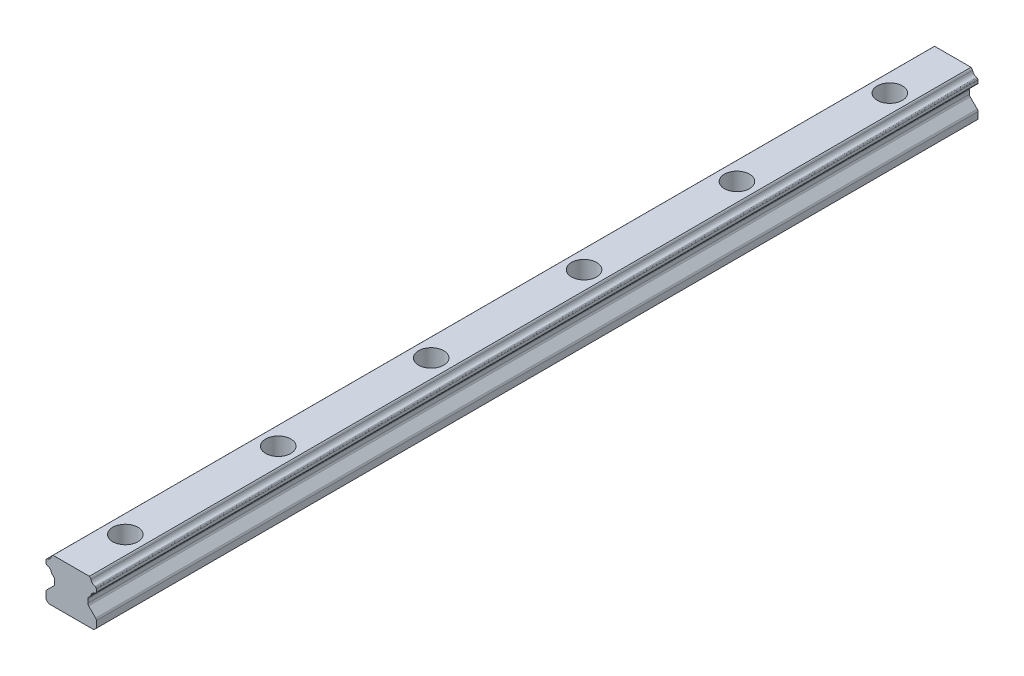
from build123d import *

# Parameters (mm, degrees)
HGR_HGR20_1_DEPTH                                   = 350
CBORE_FOR_M5_HEX_SOCKET_HEAD_CAP_SCREW1_D           = 5.8
CBORE_FOR_M5_HEX_SOCKET_HEAD_CAP_SCREW1_CBORE_D     = 10
CBORE_FOR_M5_HEX_SOCKET_HEAD_CAP_SCREW1_CBORE_DEPTH = 8.5
LPATTERN1_COUNT                                     = 6
LPATTERN1_PITCH                                     = 60.7


with BuildPart() as part:
    # Sketch12 → Hgr HGR20(1) (new body)
    with BuildSketch(Plane.XY):
        with BuildLine():
            Line((-9, 0), (9, 0))
            Line((9, 0), (10, 1))
            Line((10, 1), (10, 3.656507036))
            ThreePointArc((10, 3.656507036), (9.92387953, 4.039190479), (9.707106773, 4.363613837))
            Line((9.707106773, 4.363613837), (6.892893227, 7.177827383))
            ThreePointArc((6.892893227, 7.177827383), (6.67612047, 7.502250741), (6.6, 7.884934184))
            Line((6.6, 7.884934184), (6.6, 9.445065806))
            ThreePointArc((6.6, 9.445065806), (6.67612047, 9.827749249), (6.892893227, 10.152172607))
            Line((6.892893227, 10.152172607), (7.63016236, 10.88944174))
            ThreePointArc((7.63016236, 10.88944174), (7.773916168, 11.035785916), (7.84680643, 11.2275378))
            ThreePointArc((7.84680643, 11.2275378), (8.396388337, 12.262927707), (9.431778248, 12.812509604))
            ThreePointArc((9.431778248, 12.812509604), (9.57149389, 12.861817745), (9.690625667, 12.949905047))
            Line((9.690625667, 12.949905047), (9.85355341, 13.11283279))
            ThreePointArc((9.85355341, 13.11283279), (9.961939771, 13.275044443), (10, 13.466386134))
            Line((10, 13.466386134), (10, 14.523613846))
            ThreePointArc((10, 14.523613846), (9.961939771, 14.714955537), (9.85355341, 14.87716719))
            Line((9.85355341, 14.87716719), (9.678500884, 15.052219716))
            ThreePointArc((9.678500884, 15.052219716), (9.560417671, 15.13974885), (9.421985128, 15.189159636))
            ThreePointArc((9.421985128, 15.189159636), (8.395921997, 15.736919373), (7.84816225, 16.7629825))
            ThreePointArc((7.84816225, 16.7629825), (7.7751915, 16.95300083), (7.63253117, 17.09818942))
            Line((7.63253117, 17.09818942), (7.23072061, 17.49999998))
            Line((7.23072061, 17.49999998), (-7.23072061, 17.49999998))
            Line((-7.23072061, 17.49999998), (-7.63253117, 17.09818942))
            ThreePointArc((-7.63253117, 17.09818942), (-7.775191493, 16.953000826), (-7.84816225, 16.7629825))
            ThreePointArc((-7.84816225, 16.7629825), (-8.395921988, 15.736919382), (-9.421985103, 15.189159641))
            ThreePointArc((-9.421985103, 15.189159641), (-9.560417671, 15.139748844), (-9.678500907, 15.052219693))
            Line((-9.678500907, 15.052219693), (-9.85355341, 14.87716719))
            ThreePointArc((-9.85355341, 14.87716719), (-9.961939771, 14.714955537), (-10, 14.523613846))
            Line((-10, 14.523613846), (-10, 13.466386134))
            ThreePointArc((-10, 13.466386134), (-9.961939771, 13.275044443), (-9.85355341, 13.11283279))
            Line((-9.85355341, 13.11283279), (-9.690625709, 12.949905089))
            ThreePointArc((-9.690625709, 12.949905089), (-9.571493891, 12.861817755), (-9.431778202, 12.812509595))
            ThreePointArc((-9.431778202, 12.812509595), (-8.39638832, 12.26292769), (-7.84680643, 11.2275378))
            ThreePointArc((-7.84680643, 11.2275378), (-7.773916172, 11.035785914), (-7.63016236, 10.88944174))
            Line((-7.63016236, 10.88944174), (-6.892893227, 10.152172607))
            ThreePointArc((-6.892893227, 10.152172607), (-6.67612047, 9.827749249), (-6.6, 9.445065806))
            Line((-6.6, 9.445065806), (-6.6, 7.884934184))
            ThreePointArc((-6.6, 7.884934184), (-6.67612047, 7.502250741), (-6.892893227, 7.177827383))
            Line((-6.892893227, 7.177827383), (-9.707106773, 4.363613837))
            ThreePointArc((-9.707106773, 4.363613837), (-9.92387953, 4.039190479), (-10, 3.656507036))
            Line((-10, 3.656507036), (-10, 1))
            Line((-10, 1), (-9, 0))
        make_face()
    extrude(amount=HGR_HGR20_1_DEPTH)

    # CBORE for M5 Hex Socket Head Cap Screw1 (through all)
    with Locations(Plane(origin=(0, 17.49999998, 0), x_dir=(1, 0, 0), z_dir=(0, 1, 0))):
        with Locations((0, -25)):
            cbore_for_m5_hex_socket_head_cap_screw1 = CounterBoreHole(CBORE_FOR_M5_HEX_SOCKET_HEAD_CAP_SCREW1_D / 2, CBORE_FOR_M5_HEX_SOCKET_HEAD_CAP_SCREW1_CBORE_D / 2, CBORE_FOR_M5_HEX_SOCKET_HEAD_CAP_SCREW1_CBORE_DEPTH)

    # LPattern1: CBORE for M5 Hex Socket Head Cap Screw1 ×6
    with Locations(*[(0, 0, i * LPATTERN1_PITCH) for i in range(1, LPATTERN1_COUNT)]):
        add(cbore_for_m5_hex_socket_head_cap_screw1, mode=Mode.SUBTRACT)


solid = part.part
